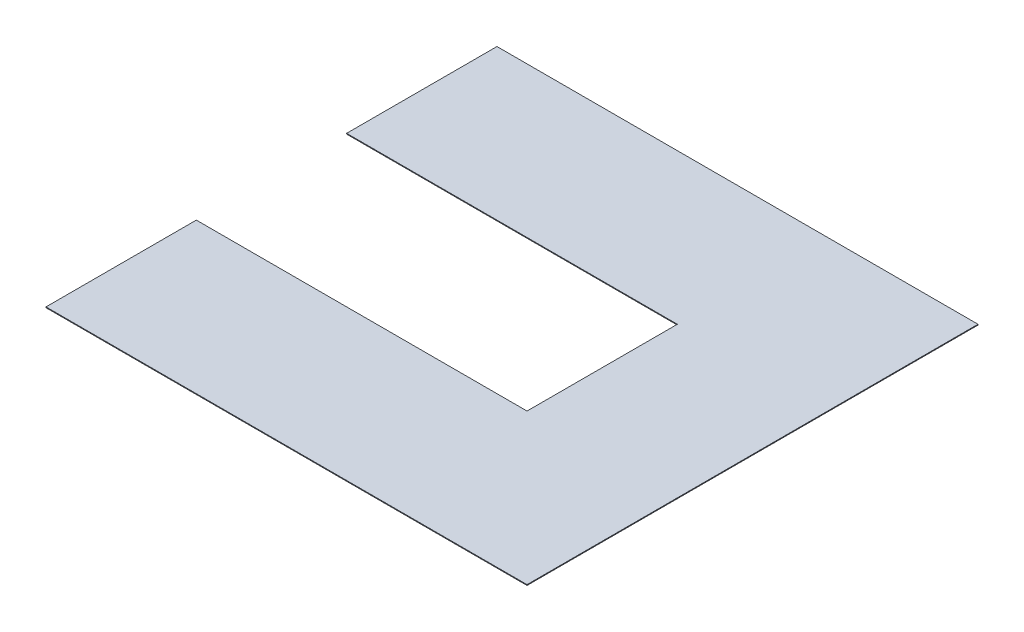
from build123d import *

# Parameters (mm, degrees)
BOSS_EXTRUDE1_DEPTH = 0.0126


with BuildPart() as part:
    # Sketch1 → Boss-Extrude1 (new body)
    with BuildSketch(Plane(origin=(0, 0, 0), x_dir=(1, 0, 0), z_dir=(0, 1, 0))):
        Polygon((0, 3.75), (0, 1.25), (5.5, 1.25), (5.5, -1.25), (0, -1.25), (0, -3.75), (8, -3.75), (8, 3.75), align=None)
    extrude(amount=BOSS_EXTRUDE1_DEPTH)


solid = part.part
